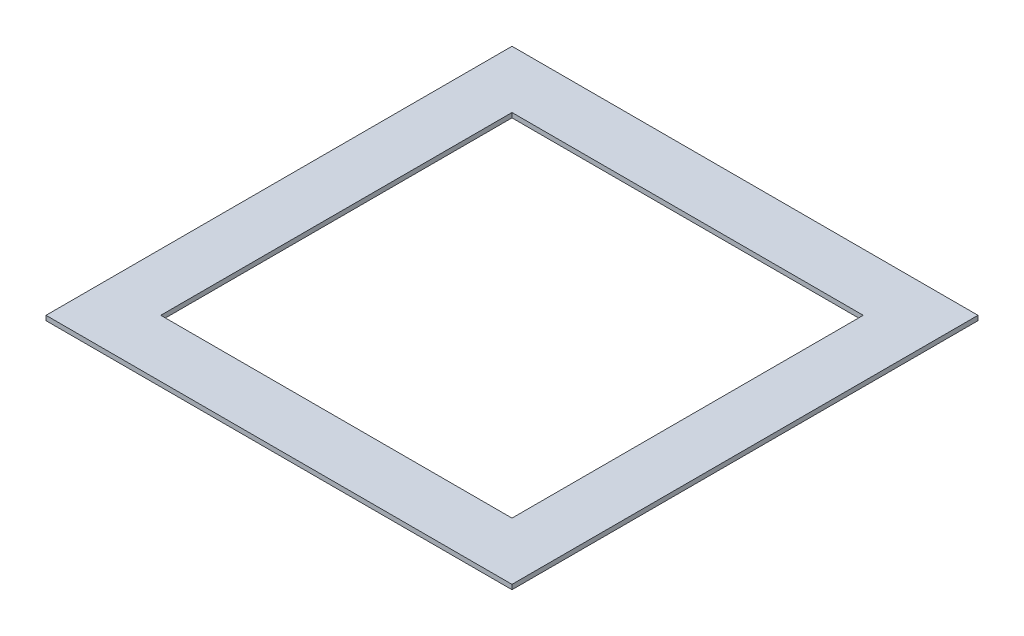
from build123d import *

# Parameters (mm, degrees)
CROQUIS1_W              = 99.5
CROQUIS1_H              = 99.5
CROQUIS1_W_2            = 75
CROQUIS1_H_2            = 75
SALIENTE_EXTRUIR1_DEPTH = 1


with BuildPart() as part:
    # Croquis1 → Saliente-Extruir1 (new body)
    with BuildSketch(Plane(origin=(0, 0, 0), x_dir=(1, 0, 0), z_dir=(0, 1, 0))):
        Rectangle(CROQUIS1_W, CROQUIS1_H)
        Rectangle(CROQUIS1_W_2, CROQUIS1_H_2, mode=Mode.SUBTRACT)
    extrude(amount=SALIENTE_EXTRUIR1_DEPTH)


solid = part.part
